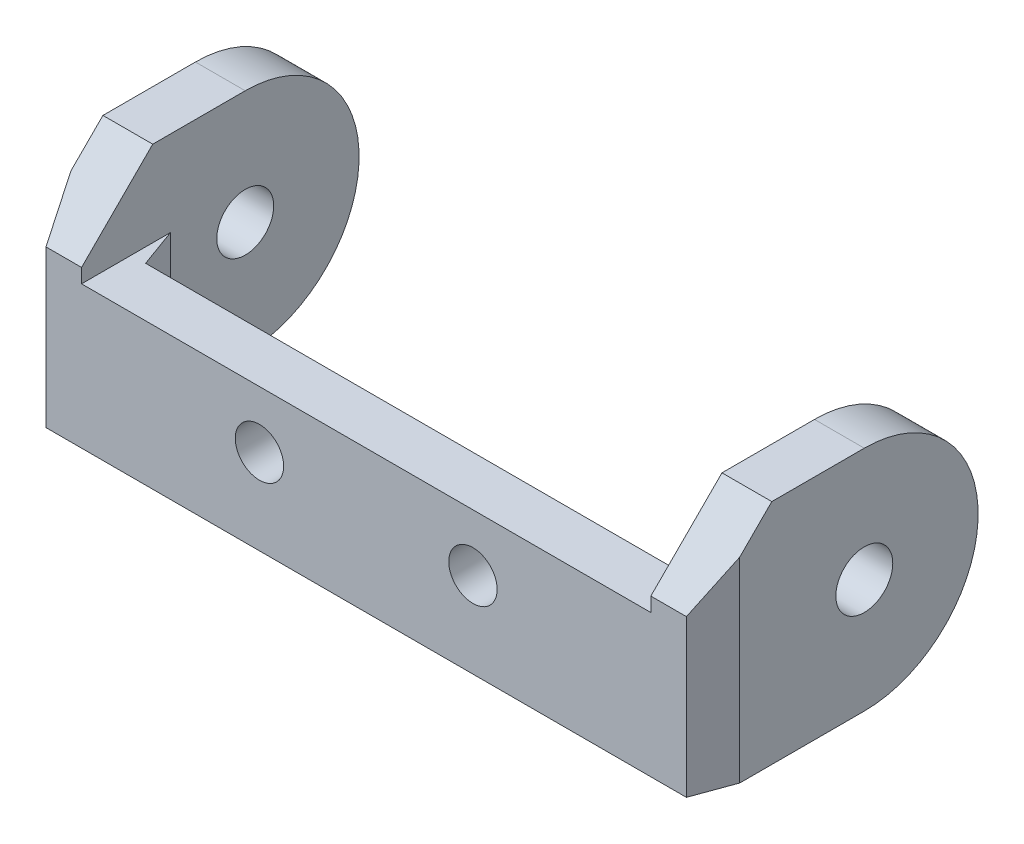
from build123d import *
from OCP.BRepFilletAPI import BRepFilletAPI_MakeChamfer

# Parameters (mm, degrees)
SKETCH_1_W          = 47
SKETCH_1_H          = 16
EXTRUDE_1_DEPTH     = 3.5
SKETCH_2_R          = 2
EXTRUDE_2_DEPTH     = 3.5
SKETCH_3_R          = 1.7
CUT_EXTRUDE_1_DEPTH = 10
SKETCH_4_W          = 40
SKETCH_4_H          = 6
CUT_EXTRUDE_2_DEPTH = 10
CHAMFER_4_SIZE      = 1
CHAMFER_4_SIZE2     = 2.747477419
CHAMFER1_SIZE       = 5


with BuildPart() as part:
    # 草图1 → 凸台-拉伸1 (new body)
    with BuildSketch(Plane.XY):
        with Locations((4, -7)):
            Rectangle(SKETCH_1_W, SKETCH_1_H)
    extrude(amount=EXTRUDE_1_DEPTH)

    # 草图2 → 凸台-拉伸2 (add)
    with BuildSketch(Plane(origin=(27.5, 0, 0), x_dir=(0, 0, -1), z_dir=(1, 0, 0))):
        with BuildLine():
            Line((0, 1), (0, -15))
            Line((0, -15), (8, -15))
            ThreePointArc((8, -15), (16, -7), (8, 1))
            Line((8, 1), (0, 1))
        make_face()
        with Locations((8, -7)):
            Circle(SKETCH_2_R, mode=Mode.SUBTRACT)
    extrude_2 = extrude(amount=-EXTRUDE_2_DEPTH)

    # 镜向1: 凸台-拉伸2 across plane
    add(extrude_2.mirror(Plane.ZY.offset(-4)))

    # 草图3 → 切除-拉伸1 (cut)
    with BuildSketch(Plane.XY.offset(3.5)):
        with Locations((11.5, -9)):
            Circle(SKETCH_3_R)
        with Locations((-3.5, -9)):
            Circle(SKETCH_3_R)
    extrude(amount=-CUT_EXTRUDE_1_DEPTH, mode=Mode.SUBTRACT)

    # 草图4 → 切除-拉伸2 (cut)
    with BuildSketch(Plane.XY.offset(3.5)):
        with Locations((4, -2)):
            Rectangle(SKETCH_4_W, SKETCH_4_H)
    extrude(amount=-CUT_EXTRUDE_2_DEPTH, mode=Mode.SUBTRACT)

    # 倒角4: one chamfer whose edges measure the first distance from different faces: ONE call of the kernel's chamfer builder (chamfer() names one face for all edges)
    chamfer_4_edges_1 = [part.edges().sort_by_distance(p)[0] for p in [
        (27.5, -7, 3.5),
        (-19.5, -7, 3.5),
    ]]
    chamfer_4_side_1 = [part.faces().sort_by_distance(p)[0] for p in [
        (4, -9.356389583, 3.5),
    ]]
    chamfer_4_edges_2 = [part.edges().sort_by_distance(p)[0] for p in [
        (-16, -10, 0),
        (24, -10, 0),
    ]]
    chamfer_4_side_2 = [part.faces().sort_by_distance(p)[0] for p in [
        (4, -10.047554813, 0),
    ]]
    chamfer_4 = BRepFilletAPI_MakeChamfer(part.part.solid().wrapped)
    for e in chamfer_4_edges_1:
        chamfer_4.Add(CHAMFER_4_SIZE, CHAMFER_4_SIZE2, e.wrapped, chamfer_4_side_1[0].wrapped)  # the first distance lies on this face
    for e in chamfer_4_edges_2:
        chamfer_4.Add(CHAMFER_4_SIZE, CHAMFER_4_SIZE2, e.wrapped, chamfer_4_side_2[0].wrapped)  # the first distance lies on this face
    add(Compound.cast(chamfer_4.Shape()), mode=Mode.REPLACE)

    # Chamfer1
    chamfer1_edges = [part.edges().sort_by_distance(p)[0] for p in [
        (-17.25, 1, 3.5),
        (25.25, 1, 3.5),
    ]]
    chamfer(chamfer1_edges, length=CHAMFER1_SIZE)


solid = part.part
